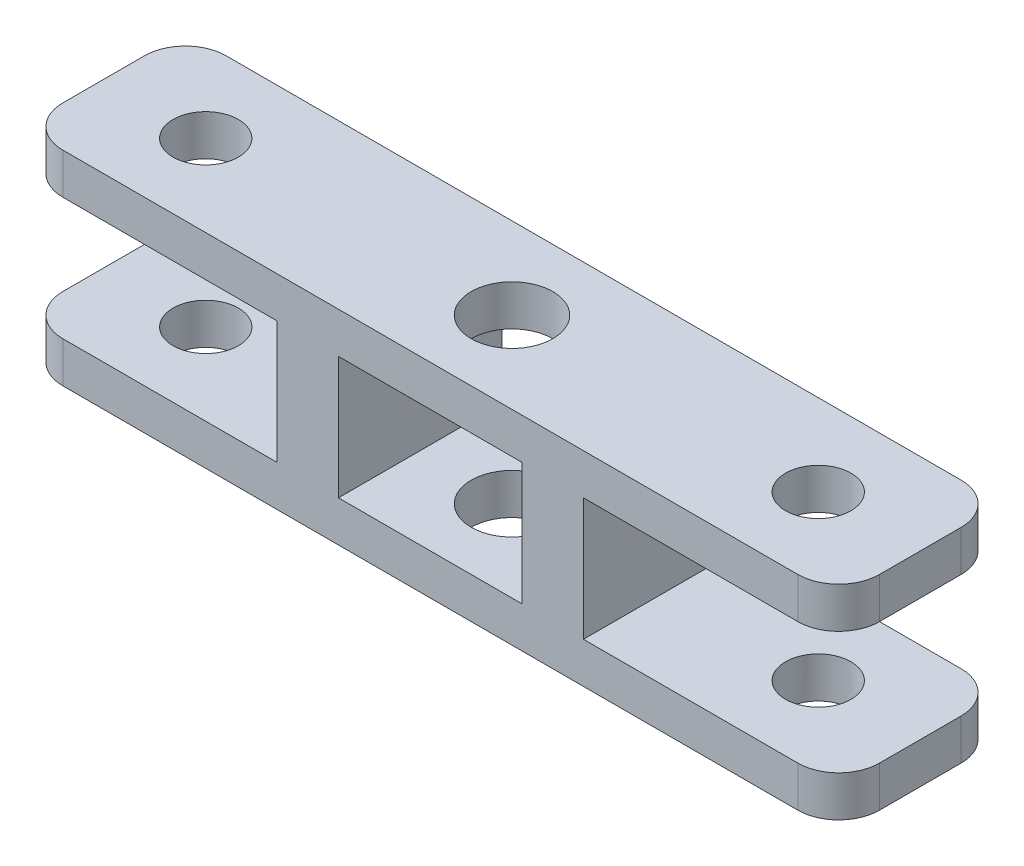
from build123d import *

# Parameters (mm, degrees)
SKETCH_1_W          = 40
SKETCH_1_H          = 8
EXTRUDE_1_DEPTH     = 2
CUT_EXTRUDE_1_REACH = 22.494
SKETCH_2_R          = 2
CUT_EXTRUDE_2_REACH = 22.494
SKETCH_3_R          = 1.6
SKETCH_4_W          = 3
SKETCH_4_H          = 8
EXTRUDE_2_DEPTH     = 6
EXTRUDE_START       = 2
SKETCH_5_W          = 40
SKETCH_5_H          = 8
SKETCH_5_R          = 1.6
SKETCH_5_R_2        = 2
EXTRUDE_3_DEPTH     = 2
FILLET_1_R          = 2


with BuildPart() as part:
    # 草图1 → 凸台-拉伸1 (new body)
    with BuildSketch(Plane(origin=(0, 0, 0), x_dir=(1, 0, 0), z_dir=(0, 1, 0))):
        Rectangle(SKETCH_1_W, SKETCH_1_H)
    extrude(amount=EXTRUDE_1_DEPTH)

    # 草图2 → 切除-拉伸1 (cut, up to next)
    with BuildSketch(Plane(origin=(0, 2, 0), x_dir=(1, 0, 0), z_dir=(0, 1, 0)), mode=Mode.PRIVATE) as cut_extrude_1_sk1:
        with Locations(Location((0, 0, 0), (0, 0, 270))):
            Circle(SKETCH_2_R)
    cut_extrude_1_tool1 = extrude(cut_extrude_1_sk1.sketch, amount=-CUT_EXTRUDE_1_REACH, mode=Mode.PRIVATE) & part.part
    add(cut_extrude_1_tool1.solids().sort_by_distance((0, 2, 0))[0], mode=Mode.SUBTRACT)

    # 草图3 → 切除-拉伸2 (cut, up to next)
    with BuildSketch(Plane(origin=(0, 2, 0), x_dir=(1, 0, 0), z_dir=(0, 1, 0)), mode=Mode.PRIVATE) as cut_extrude_2_sk1:
        with Locations(Location((15, 0, 0), (0, 0, 270))):
            Circle(SKETCH_3_R)
    cut_extrude_2_tool1 = extrude(cut_extrude_2_sk1.sketch, amount=-CUT_EXTRUDE_2_REACH, mode=Mode.PRIVATE) & part.part
    # 草图3 → 切除-拉伸2 (cut, up to next)
    with BuildSketch(Plane(origin=(0, 2, 0), x_dir=(1, 0, 0), z_dir=(0, 1, 0)), mode=Mode.PRIVATE) as cut_extrude_2_sk2:
        with Locations(Location((-15, 0, 0), (0, 0, 90))):
            Circle(SKETCH_3_R)
    cut_extrude_2_tool2 = extrude(cut_extrude_2_sk2.sketch, amount=-CUT_EXTRUDE_2_REACH, mode=Mode.PRIVATE) & part.part
    add(cut_extrude_2_tool1.solids().sort_by_distance((15, 2, 0))[0], mode=Mode.SUBTRACT)
    add(cut_extrude_2_tool2.solids().sort_by_distance((-15, 2, 0))[0], mode=Mode.SUBTRACT)

    # 草图4 → 凸台-拉伸2 (add)
    with BuildSketch(Plane(origin=(0, 2, 0), x_dir=(1, 0, 0), z_dir=(0, 1, 0))):
        with Locations((-6, 0)):
            Rectangle(SKETCH_4_W, SKETCH_4_H)
        with Locations((6, 0)):
            Rectangle(SKETCH_4_W, SKETCH_4_H)
    extrude(amount=EXTRUDE_2_DEPTH)

    # 草图5 → 凸台-拉伸3 (add)
    with BuildSketch(Plane(origin=(0, 8, 0), x_dir=(1, 0, 0), z_dir=(0, 1, 0)).offset(EXTRUDE_START)):
        Rectangle(SKETCH_5_W, SKETCH_5_H)
        with Locations(Location((15, 0, 0), (0, 0, 270))):
            Circle(SKETCH_5_R, mode=Mode.SUBTRACT)
        with Locations(Location((0, 0, 0), (0, 0, 270))):
            Circle(SKETCH_5_R_2, mode=Mode.SUBTRACT)
        with Locations(Location((-15, 0, 0), (0, 0, 90))):
            Circle(SKETCH_5_R, mode=Mode.SUBTRACT)
    extrude(amount=-EXTRUDE_3_DEPTH)

    # 圆角1
    fillet_1_edges = [part.edges().sort_by_distance(p)[0] for p in [
        (20, 9, 4),
        (20, 9, -4),
        (-20, 9, -4),
        (-20, 9, 4),
        (20, 1, 4),
        (-20, 1, 4),
        (-20, 1, -4),
        (20, 1, -4),
    ]]
    fillet(fillet_1_edges, radius=FILLET_1_R)


solid = part.part
